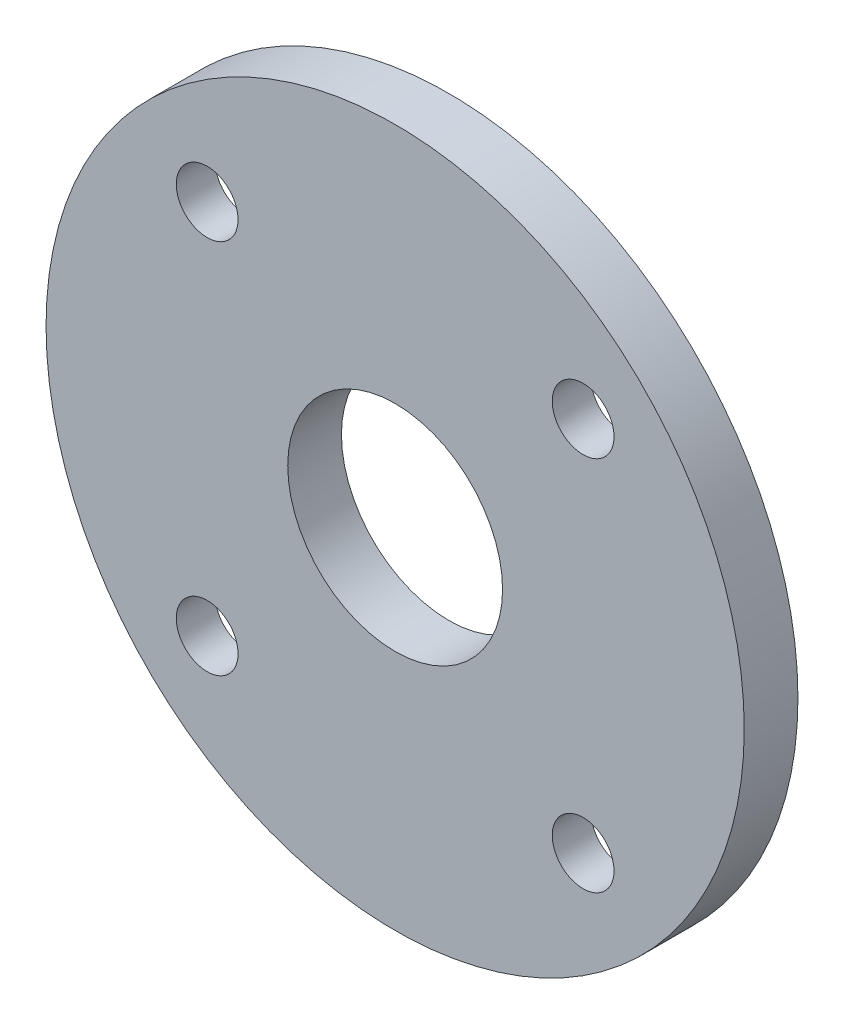
from build123d import *

# Parameters (mm, degrees)
CAP_OD26_ID8_THICKNESS2_PROFILE_R   = 13
CAP_OD26_ID8_THICKNESS2_PROFILE_R_2 = 4
CAP_OD26_ID8_THICKNESS2_DEPTH       = 2
FOUR_M2_CAPTURE_HOLES_START         = -50
FOUR_M2_CAPTURE_HOLES_PROFILE_R     = 1.15
FOUR_M2_CAPTURE_HOLES_DEPTH         = 69.493242009
LOW_PROFILE_HEAD_SEATS_R            = 2.1
HEAD_RECESS_DEPTH0P55_DEPTH         = 0.55


with BuildPart() as part:
    # Cap_OD26_ID8_thickness2_profile → Cap_OD26_ID8_thickness2 (new body)
    with BuildSketch(Plane.XY):
        Circle(CAP_OD26_ID8_THICKNESS2_PROFILE_R)
        Circle(CAP_OD26_ID8_THICKNESS2_PROFILE_R_2, mode=Mode.SUBTRACT)
    extrude(amount=CAP_OD26_ID8_THICKNESS2_DEPTH)

    # Four_M2_capture_holes_profile → Four_M2_capture_holes (cut, through all)
    with BuildSketch(Plane.XY.offset(FOUR_M2_CAPTURE_HOLES_START)):
        with Locations((7, 7)):
            Circle(FOUR_M2_CAPTURE_HOLES_PROFILE_R)
        with Locations((-7, 7)):
            Circle(FOUR_M2_CAPTURE_HOLES_PROFILE_R)
        with Locations((-7, -7)):
            Circle(FOUR_M2_CAPTURE_HOLES_PROFILE_R)
        with Locations((7, -7)):
            Circle(FOUR_M2_CAPTURE_HOLES_PROFILE_R)
    extrude(amount=FOUR_M2_CAPTURE_HOLES_DEPTH, mode=Mode.SUBTRACT)

    # Low_profile_head_seats → Head_recess_depth0p55 (cut)
    with BuildSketch(Plane.XY):
        with Locations((7, 7)):
            Circle(LOW_PROFILE_HEAD_SEATS_R)
        with Locations((-7, 7)):
            Circle(LOW_PROFILE_HEAD_SEATS_R)
        with Locations((-7, -7)):
            Circle(LOW_PROFILE_HEAD_SEATS_R)
        with Locations((7, -7)):
            Circle(LOW_PROFILE_HEAD_SEATS_R)
    extrude(amount=HEAD_RECESS_DEPTH0P55_DEPTH, mode=Mode.SUBTRACT)


solid = part.part
